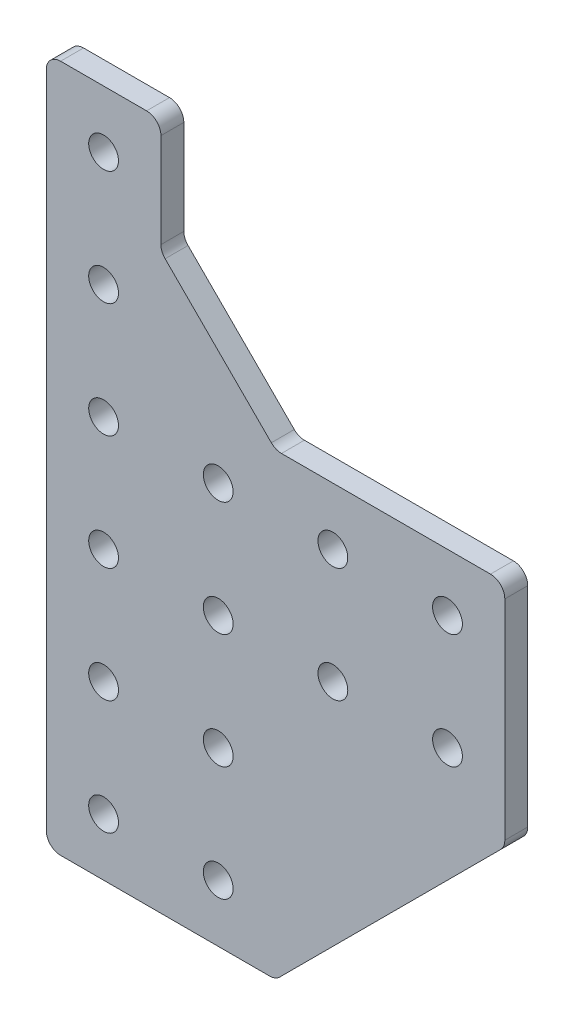
from build123d import *

# Parameters (mm, degrees)
SKETCH_1_R      = 2.6
EXTRUDE_1_DEPTH = 4


with BuildPart() as part:
    # Эскиз1 → Бобышка-Вытянуть1 (new body)
    with BuildSketch(Plane.XY):
        with BuildLine():
            Line((40.732233047, -79.267766953), (79.267766953, -40.732233047))
            ThreePointArc((79.267766953, -40.732233047), (79.809698831, -39.921174675), (80, -38.964466094))
            Line((80, -38.964466094), (80, -2.5))
            ThreePointArc((80, -2.5), (79.267766953, -0.732233047), (77.5, 0))
            Line((77.5, 0), (41.035533906, 0))
            ThreePointArc((41.035533906, 0), (40.078825325, 0.190301169), (39.267766953, 0.732233047))
            Line((39.267766953, 0.732233047), (20.732233047, 19.267766953))
            ThreePointArc((20.732233047, 19.267766953), (20.190301169, 20.078825325), (20, 21.035533906))
            Line((20, 21.035533906), (20, 37.5))
            ThreePointArc((20, 37.5), (19.267766953, 39.267766953), (17.5, 40))
            Line((17.5, 40), (2.5, 40))
            ThreePointArc((2.5, 40), (0.732233047, 39.267766953), (0, 37.5))
            Line((0, 37.5), (0, 0))
            Line((0, 0), (0, -77.5))
            ThreePointArc((0, -77.5), (0.732233047, -79.267766953), (2.5, -80))
            Line((2.5, -80), (38.964466094, -80))
            ThreePointArc((38.964466094, -80), (39.921174675, -79.809698831), (40.732233047, -79.267766953))
        make_face()
        with Locations((10, -10)):
            Circle(SKETCH_1_R, mode=Mode.SUBTRACT)
        with Locations((30, -10)):
            Circle(SKETCH_1_R, mode=Mode.SUBTRACT)
        with Locations((30, -30)):
            Circle(SKETCH_1_R, mode=Mode.SUBTRACT)
        with Locations((30, -50)):
            Circle(SKETCH_1_R, mode=Mode.SUBTRACT)
        with Locations((30, -70)):
            Circle(SKETCH_1_R, mode=Mode.SUBTRACT)
        with Locations((10, -30)):
            Circle(SKETCH_1_R, mode=Mode.SUBTRACT)
        with Locations((10, -50)):
            Circle(SKETCH_1_R, mode=Mode.SUBTRACT)
        with Locations((10, -70)):
            Circle(SKETCH_1_R, mode=Mode.SUBTRACT)
        with Locations((50, -10)):
            Circle(SKETCH_1_R, mode=Mode.SUBTRACT)
        with Locations((50, -30)):
            Circle(SKETCH_1_R, mode=Mode.SUBTRACT)
        with Locations((70, -10)):
            Circle(SKETCH_1_R, mode=Mode.SUBTRACT)
        with Locations((70, -30)):
            Circle(SKETCH_1_R, mode=Mode.SUBTRACT)
        with Locations((10, 10)):
            Circle(SKETCH_1_R, mode=Mode.SUBTRACT)
        with Locations((10, 30)):
            Circle(SKETCH_1_R, mode=Mode.SUBTRACT)
    extrude(amount=EXTRUDE_1_DEPTH)


solid = part.part
